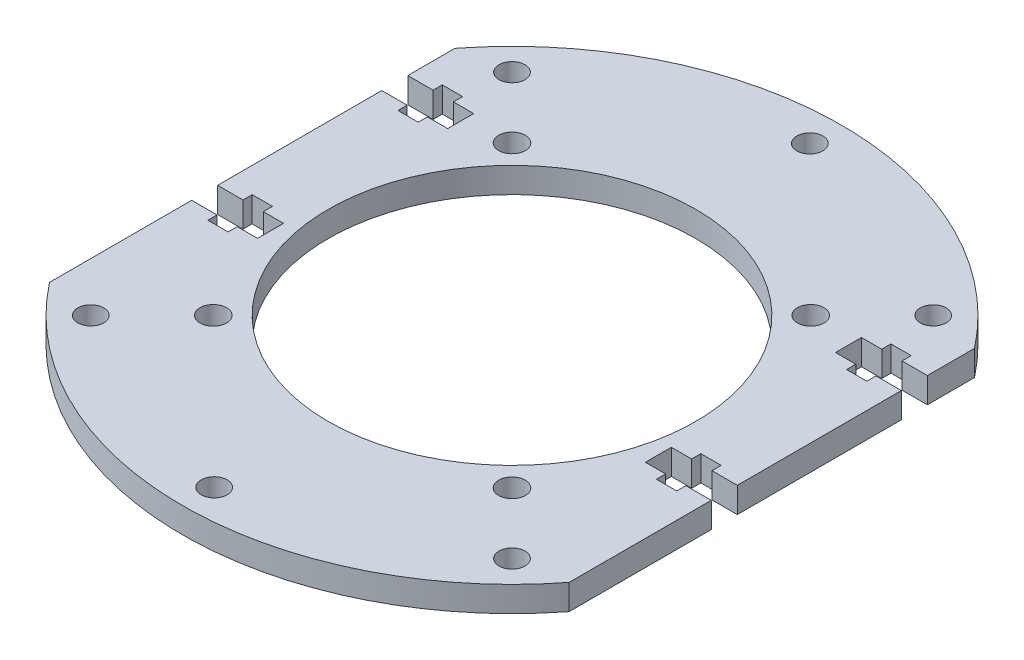
from build123d import *

# Parameters (mm, degrees)
SKETCH_1_R          = 52
SKETCH_1_R_2        = 29
SKETCH_1_R_3        = 2.05
SKETCH_1_R_4        = 2.1
EXTRUDE_1_DEPTH     = 4
SKETCH_2_W          = 182
SKETCH_2_H          = 210.035227354
SKETCH_2_W_2        = 82
SKETCH_2_H_2        = 110.035227354
CUT_EXTRUDE_1_DEPTH = 4


with BuildPart() as part:
    # 草图1 → 凸台-拉伸1 (new body)
    with BuildSketch(Plane(origin=(0, 0, 0), x_dir=(1, 0, 0), z_dir=(0, 1, 0))):
        with Locations(Location((0, 0, 0), (0, 0, 270))):
            Circle(SKETCH_1_R)
        with Locations(Location((0, 0, 0), (0, 0, 270))):
            Circle(SKETCH_1_R_2, mode=Mode.SUBTRACT)
        with Locations(Location((47, 0, 0), (0, 0, 270))):
            Circle(SKETCH_1_R_3, mode=Mode.SUBTRACT)
        with Locations(Location((33.234018716, -33.234018716, 0), (0, 0, 270))):
            Circle(SKETCH_1_R_3, mode=Mode.SUBTRACT)
        with Locations(Location((0, -47, 0), (0, 0, 270))):
            Circle(SKETCH_1_R_3, mode=Mode.SUBTRACT)
        with Locations(Location((-33.234018716, -33.234018716, 0), (0, 0, 270))):
            Circle(SKETCH_1_R_3, mode=Mode.SUBTRACT)
        with Locations(Location((-47, 0, 0), (0, 0, 270))):
            Circle(SKETCH_1_R_3, mode=Mode.SUBTRACT)
        with Locations(Location((-33.234018716, 33.234018716, 0), (0, 0, 270))):
            Circle(SKETCH_1_R_3, mode=Mode.SUBTRACT)
        with Locations(Location((0, 47, 0), (0, 0, 270))):
            Circle(SKETCH_1_R_3, mode=Mode.SUBTRACT)
        with Locations(Location((33.234018716, 33.234018716, 0), (0, 0, 270))):
            Circle(SKETCH_1_R_3, mode=Mode.SUBTRACT)
        with Locations(Location((-23.57, 23.57, 0), (0, 0, 270))):
            Circle(SKETCH_1_R_4, mode=Mode.SUBTRACT)
        with Locations(Location((-23.57, -23.57, 0), (0, 0, 270))):
            Circle(SKETCH_1_R_4, mode=Mode.SUBTRACT)
        with Locations(Location((23.57, -23.57, 0), (0, 0, 90))):
            Circle(SKETCH_1_R_4, mode=Mode.SUBTRACT)
        with Locations(Location((23.57, 23.57, 0), (0, 0, 90))):
            Circle(SKETCH_1_R_4, mode=Mode.SUBTRACT)
        Polygon((37, -9.55), (37, -11), (33.8, -11), (33.8, -9.55), (30.6, -9.55), (30.6, -5.45), (33.8, -5.45), (33.8, -4), (37, -4), (37, -5.45), (41, -5.45), (41, -9.55), align=None, mode=Mode.SUBTRACT)
        Polygon((37, 20.45), (37, 19), (33.8, 19), (33.8, 20.45), (30.6, 20.45), (30.6, 24.55), (33.8, 24.55), (33.8, 26), (37, 26), (37, 24.55), (41, 24.55), (41, 20.45), align=None, mode=Mode.SUBTRACT)
        Polygon((-33.8, 26), (-37, 26), (-37, 24.55), (-41, 24.55), (-41, 20.45), (-37, 20.45), (-37, 19), (-33.8, 19), (-33.8, 20.45), (-30.6, 20.45), (-30.6, 24.55), (-33.8, 24.55), align=None, mode=Mode.SUBTRACT)
        Polygon((-33.8, -4), (-37, -4), (-37, -5.45), (-41, -5.45), (-41, -9.55), (-37, -9.55), (-37, -11), (-33.8, -11), (-33.8, -9.55), (-30.6, -9.55), (-30.6, -5.45), (-33.8, -5.45), align=None, mode=Mode.SUBTRACT)
    extrude(amount=EXTRUDE_1_DEPTH)

    # 草图2 → 切除-拉伸-薄壁1 (cut)
    with BuildSketch(Plane(origin=(0, 4, 0), x_dir=(1, 0, 0), z_dir=(0, 1, 0))):
        Rectangle(SKETCH_2_W, SKETCH_2_H)
        Rectangle(SKETCH_2_W_2, SKETCH_2_H_2, mode=Mode.SUBTRACT)
    extrude(amount=-CUT_EXTRUDE_1_DEPTH, mode=Mode.SUBTRACT)


solid = part.part
